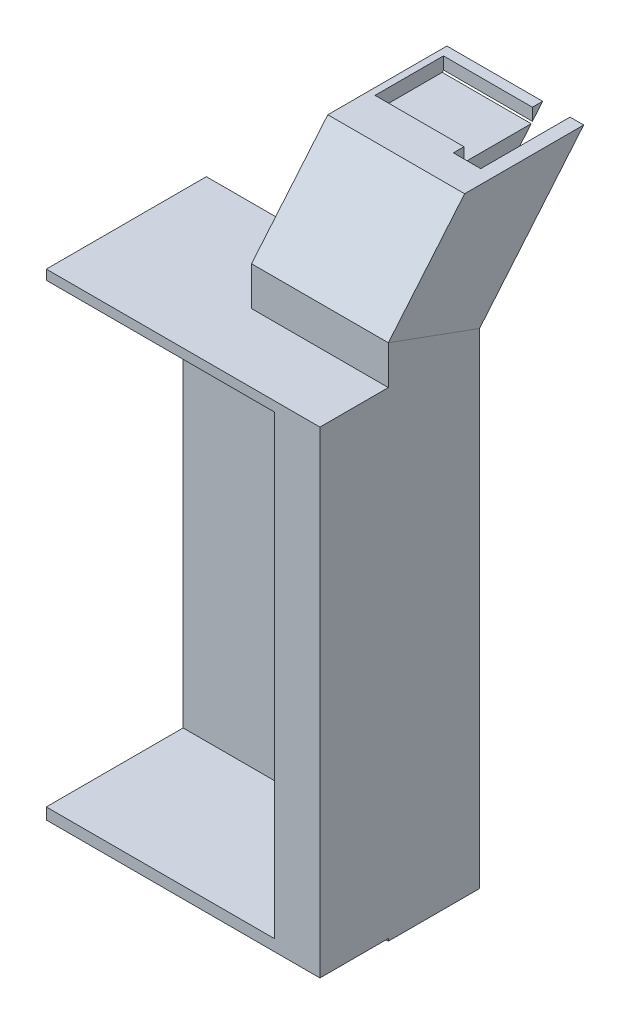
from build123d import *

# Parameters (mm, degrees)
SKETCH_1_W           = 30
SKETCH_1_H           = 20
SKETCH_16_W          = 6
SKETCH_16_H          = 15
SKETCH_20_W          = 44.009262039
SKETCH_20_H          = 100
ARDUINO_DEPTH        = 15
SKETCH_36_W          = 15
SKETCH_36_H          = 10
EXTRUDE_1_DEPTH      = 10
CUT_EXTRUDE_25_DEPTH = 15
CUT_EXTRUDE_28_DEPTH = 30
SKETCH_41_W          = 19.503659652
SKETCH_41_H          = 15
CUT_EXTRUDE_29_DEPTH = 3
EXTRUDE_2_DEPTH      = 30
SKETCH_46_W          = 30
SKETCH_46_H          = 100
CUT_EXTRUDE_31_DEPTH = 15
EXTRUDE_3_DEPTH      = 15
SKETCH_48_W          = 6
SKETCH_48_H          = 100
CUT_EXTRUDE_32_DEPTH = 5
SKETCH_49_R          = 1.5
CUT_EXTRUDE_33_DEPTH = 15


with BuildPart() as part:
    # 扫描1: sweep along a path in 草图2
    with BuildLine(Plane(origin=(-2.57, 0, 0), x_dir=(0, 0, -1), z_dir=(1, 0, 0))) as sweep_1_path:
        Line((-5.367132867, 0), (-5.367132867, 110))
        Line((-5.367132867, 110), (19.805856068, 140))
    # 草图1 → 扫描1 (sweep)
    with BuildSketch(Plane(origin=(0, 0, 0), x_dir=(1, 0, 0), z_dir=(0, 1, 0))):
        with Locations((-2.56993007, -5.367132867)):
            Rectangle(SKETCH_1_W, SKETCH_1_H)
    sweep(path=sweep_1_path.line, transition=Transition.RIGHT)

    # 切除-扫描2: sweep along a path in 草图19
    with BuildLine(Plane(origin=(6.43006993, 0, 0), x_dir=(0, 0, -1), z_dir=(1, 0, 0))) as sweep_2_path:
        Line((21.720967176, 138.393030976), (-2.867132867, 109.090074414))
        Line((-2.867132867, 109.090074414), (-2.867132867, 0))
    # 草图16 → 切除-扫描2 (sweep, cut)
    with BuildSketch(Plane(origin=(0, 91.907852742, -77.119845338), x_dir=(1, 0, 0), z_dir=(0, 0.7660444431189769, -0.6427876096865407))):
        with Locations((6.43006993, -72.318099374)):
            Rectangle(SKETCH_16_W, SKETCH_16_H)
    sweep(path=sweep_2_path.line, transition=Transition.RIGHT, mode=Mode.SUBTRACT)

    # 草图20 → arduino (cut)
    with BuildSketch(Plane.XY.offset(15.367132867)):
        with Locations((-19.57456109, 53)):
            Rectangle(SKETCH_20_W, SKETCH_20_H)
    extrude(amount=-ARDUINO_DEPTH, mode=Mode.SUBTRACT)

    # 草图36 → 凸台-拉伸1 (add)
    with BuildSketch(Plane.XZ):
        with Locations((-10.06993007, 10.367132867)):
            Rectangle(SKETCH_36_W, SKETCH_36_H)
    extrude(amount=EXTRUDE_1_DEPTH)

    # 草图37 → 切除-拉伸25 (cut)
    with BuildSketch(Plane.ZY.offset(17.56993007)):
        with BuildLine():
            Line((5.367132867, -10), (5.367132867, -5))
            ThreePointArc((5.367132867, -5), (6.831598961, -8.535533906), (10.367132867, -10))
            Line((10.367132867, -10), (5.367132867, -10))
        make_face()
    extrude(amount=-CUT_EXTRUDE_25_DEPTH, mode=Mode.SUBTRACT)

    # 草图40 → 切除-拉伸28 (cut)
    with BuildSketch(Plane.ZY.offset(17.56993007)):
        Polygon((-27.466300499, 133.572123903), (-1.358154713, 133.572123903), (-12.145411637, 146.427876097), align=None)
    extrude(amount=-CUT_EXTRUDE_28_DEPTH, mode=Mode.SUBTRACT)

    # 草图41 → 切除-拉伸29 (cut)
    with BuildSketch(Plane(origin=(0, 133.572123903, 0), x_dir=(1, 0, 0), z_dir=(0, 1, 0))):
        with Locations((-6.321759896, 17.716300499)):
            Rectangle(SKETCH_41_W, SKETCH_41_H)
    extrude(amount=-CUT_EXTRUDE_29_DEPTH, mode=Mode.SUBTRACT)

    # 草图42 → 凸台-拉伸2 (add)
    with BuildSketch(Plane.ZY.offset(17.56993007)):
        Polygon((-4.730811685, 105.128164413), (-4.632867133, 0.51377094), (15.367132867, 0.51377094), (15.367132867, 105.128164413), align=None)
    extrude(amount=EXTRUDE_2_DEPTH)

    # 草图46 → 切除-拉伸31 (cut)
    with BuildSketch(Plane.XY.offset(15.367132867)):
        with Locations((-32.56993007, 53)):
            Rectangle(SKETCH_46_W, SKETCH_46_H)
    extrude(amount=-CUT_EXTRUDE_31_DEPTH, mode=Mode.SUBTRACT)

    # 草图47 → 凸台-拉伸3 (add)
    with BuildSketch(Plane.XY.offset(15.367132867)):
        Polygon((-47.56993007, 105.128164413), (-47.56993007, 103), (2.43006993, 103), (2.43006993, 3), (-47.56993007, 3), (-47.56993007, 0.51377094), (12.43006993, 0.51377094), (12.43006993, 105.128164413), align=None)
    extrude(amount=EXTRUDE_3_DEPTH)

    # 草图48 → 切除-拉伸32 (cut)
    with BuildSketch(Plane.ZY.offset(-2.43006993)):
        with Locations((5.88172197, 53)):
            Rectangle(SKETCH_48_W, SKETCH_48_H)
    extrude(amount=-CUT_EXTRUDE_32_DEPTH, mode=Mode.SUBTRACT)

    # 草图49 → 切除-拉伸33 (cut)
    with BuildSketch(Plane.ZY.offset(17.56993007)):
        with Locations((10.367132867, -5)):
            Circle(SKETCH_49_R)
    extrude(amount=-CUT_EXTRUDE_33_DEPTH, mode=Mode.SUBTRACT)


solid = part.part
